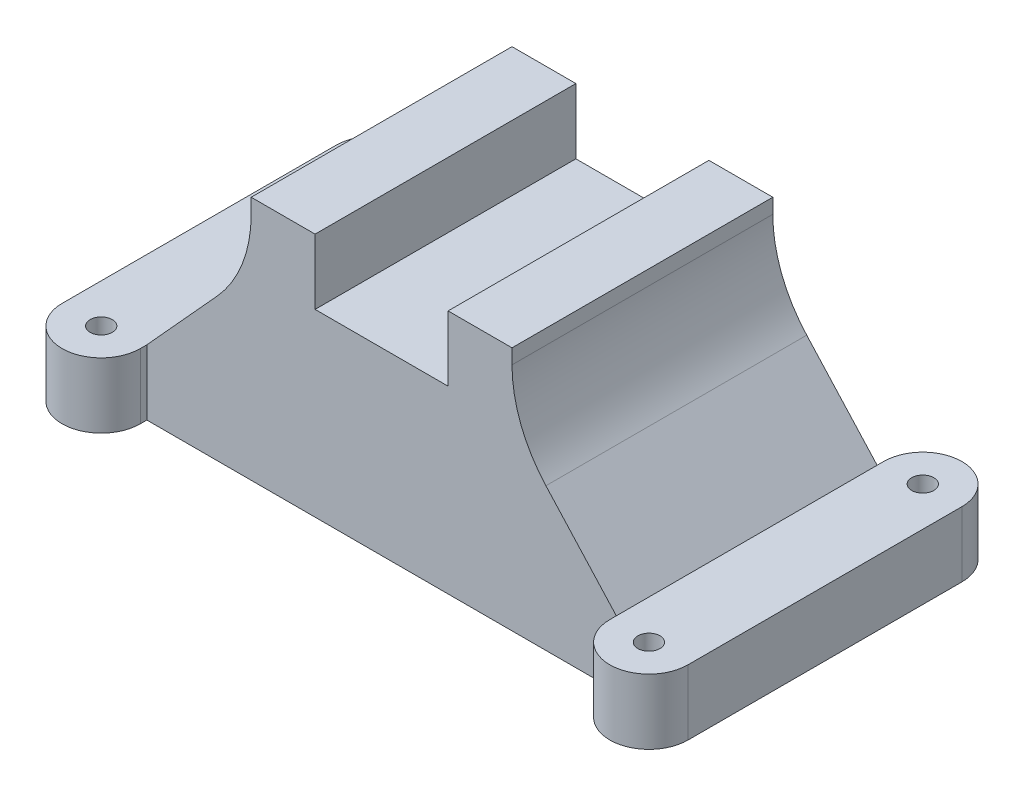
from build123d import *

# Parameters (mm, degrees)
SKETCH_1_R           = 0.85
EXTRUDE_1_DEPTH      = 5
EXTRUDE_1_2_DEPTH    = 5
EXTRUDE_2_DEPTH      = 10
EXTRUDE_3_DEPTH      = 10
EXTRUDE_3_DEPTH_BACK = 10
SKETCH_3_W           = 4.9
SKETCH_3_H           = 5
FILLET_1_R           = 10


with BuildPart() as part:
    # ｽｹｯﾁ1 → ﾎﾞｽ - 押し出し1 (new body)
    with BuildSketch(Plane(origin=(0, 0, 0), x_dir=(1, 0, 0), z_dir=(0, 1, 0))):
        with BuildLine():
            Line((-18, -10.5), (-18, 10.5))
            ThreePointArc((-18, 10.5), (-21, 13.5), (-24, 10.5))
            Line((-24, 10.5), (-24, -10.5))
            ThreePointArc((-24, -10.5), (-21, -13.5), (-18, -10.5))
        make_face()
        with Locations((-21, -10.5)):
            Circle(SKETCH_1_R, mode=Mode.SUBTRACT)
        with Locations((-21, 10.5)):
            Circle(SKETCH_1_R, mode=Mode.SUBTRACT)
    extrude(amount=EXTRUDE_1_DEPTH)



with BuildPart() as body_2:
    # ｽｹｯﾁ1 → Extrude 1 2 (new body)
    with BuildSketch(Plane(origin=(0, 0, 0), x_dir=(1, 0, 0), z_dir=(0, 1, 0))):
        with BuildLine():
            ThreePointArc((24, 10.5), (21, 13.5), (18, 10.5))
            Line((18, 10.5), (18, -10.5))
            ThreePointArc((18, -10.5), (21, -13.5), (24, -10.5))
            Line((24, -10.5), (24, 10.5))
        make_face()
        with Locations((21, -10.5)):
            Circle(SKETCH_1_R, mode=Mode.SUBTRACT)
        with Locations((21, 10.5)):
            Circle(SKETCH_1_R, mode=Mode.SUBTRACT)
    extrude(amount=EXTRUDE_1_2_DEPTH)


with BuildPart() as part_1:
    add(part.part)

    add(body_2.part)  # ﾎﾞｽ - 押し出し2 merges body 2
    # ｽｹｯﾁ2 → ﾎﾞｽ - 押し出し2 (add, symmetric)
    with BuildSketch(Plane.XY):
        Polygon((-18, 5), (-18, 0), (18, 0), (18, 5), (10, 13.8), (-10, 13.8), align=None)
    extrude(amount=EXTRUDE_2_DEPTH, both=True)

    # ｽｹｯﾁ3 → ﾎﾞｽ - 押し出し3 (add, two sides: drawn at the far end of the back side and taken through both)
    with BuildSketch(Plane.XY.offset(-EXTRUDE_3_DEPTH_BACK)):
        with Locations((-7.55, 16.3)):
            Rectangle(SKETCH_3_W, SKETCH_3_H)
        with Locations((7.55, 16.3)):
            Rectangle(SKETCH_3_W, SKETCH_3_H)
    extrude(amount=EXTRUDE_3_DEPTH + EXTRUDE_3_DEPTH_BACK)

    # ﾌｨﾚｯﾄ1
    fillet_1_edges = [part_1.edges().sort_by_distance(p)[0] for p in [
        (10, 13.8, 0),
        (-10, 13.8, 0),
    ]]
    fillet(fillet_1_edges, radius=FILLET_1_R)


solid = part_1.part
